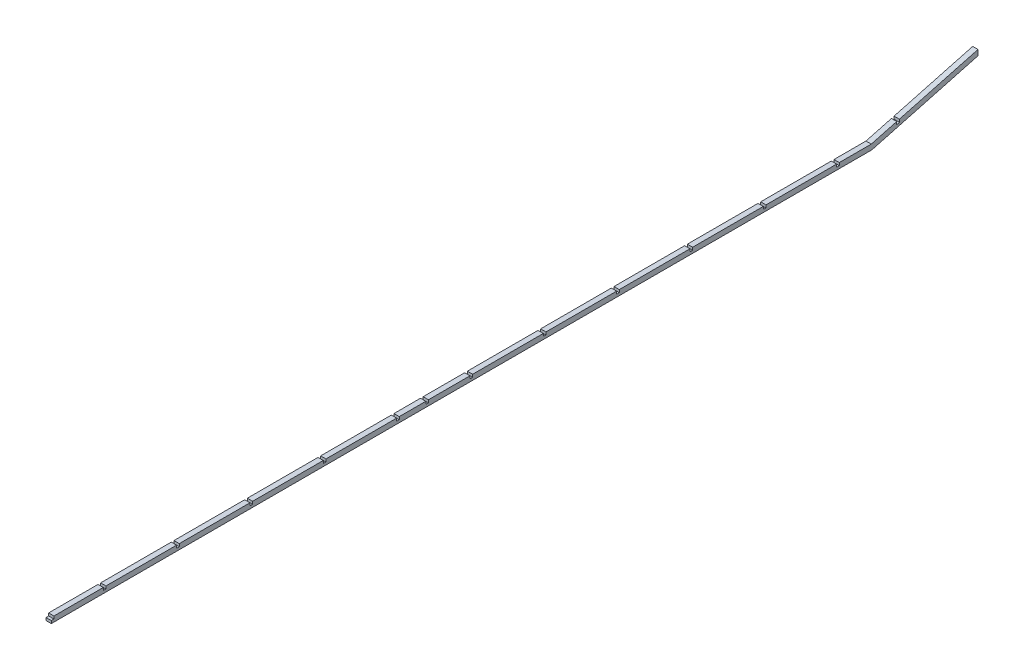
from build123d import *

# Parameters (mm, degrees)
EXTRUDE_1_DEPTH = 6


with BuildPart() as part:
    # Эскиз1 → Бобышка-Вытянуть1 (new body)
    with BuildSketch(Plane(origin=(0, 0, 0), x_dir=(0, 0, -1), z_dir=(1, 0, 0))):
        Polygon((-413.956983993, 0), (514.903016007, 0), (634.899981407, 32.153089973), (634.899981407, 38.364747056), (545.905205711, 14.518668777), (545.905205711, 11.412840236), (542.905205711, 10.608992659), (542.905205711, 13.7148212), (514.113101021, 6), (477.903016007, 6), (477.903016007, 3), (474.903016007, 3), (474.903016007, 6), (394.903016007, 6), (394.903016007, 3), (391.903016007, 3), (391.903016007, 6), (311.903016007, 6), (311.903016007, 3), (308.903016007, 3), (308.903016007, 6), (228.903016007, 6), (228.903016007, 3), (225.903016007, 3), (225.903016007, 6), (145.903016007, 6), (145.903016007, 3), (142.903016007, 3), (142.903016007, 6), (62.903016007, 6), (62.903016007, 3), (59.903016007, 3), (59.903016007, 6), (12.903016007, 6), (12.903016007, 3), (9.903016007, 3), (9.903016007, 6), (-20.096983993, 6), (-20.096983993, 3), (-23.096983993, 3), (-23.096983993, 6), (-103.096983993, 6), (-103.096983993, 3), (-106.096983993, 3), (-106.096983993, 6), (-186.096983993, 6), (-186.096983993, 3), (-189.096983993, 3), (-189.096983993, 6), (-269.096983993, 6), (-269.096983993, 3), (-272.096983993, 3), (-272.096983993, 6), (-352.096983993, 6), (-352.096983993, 3), (-355.096983993, 3), (-355.096983993, 6), (-410.956983993, 6), (-410.956983993, 3), (-413.956983993, 3), align=None)
    extrude(amount=EXTRUDE_1_DEPTH)


solid = part.part
